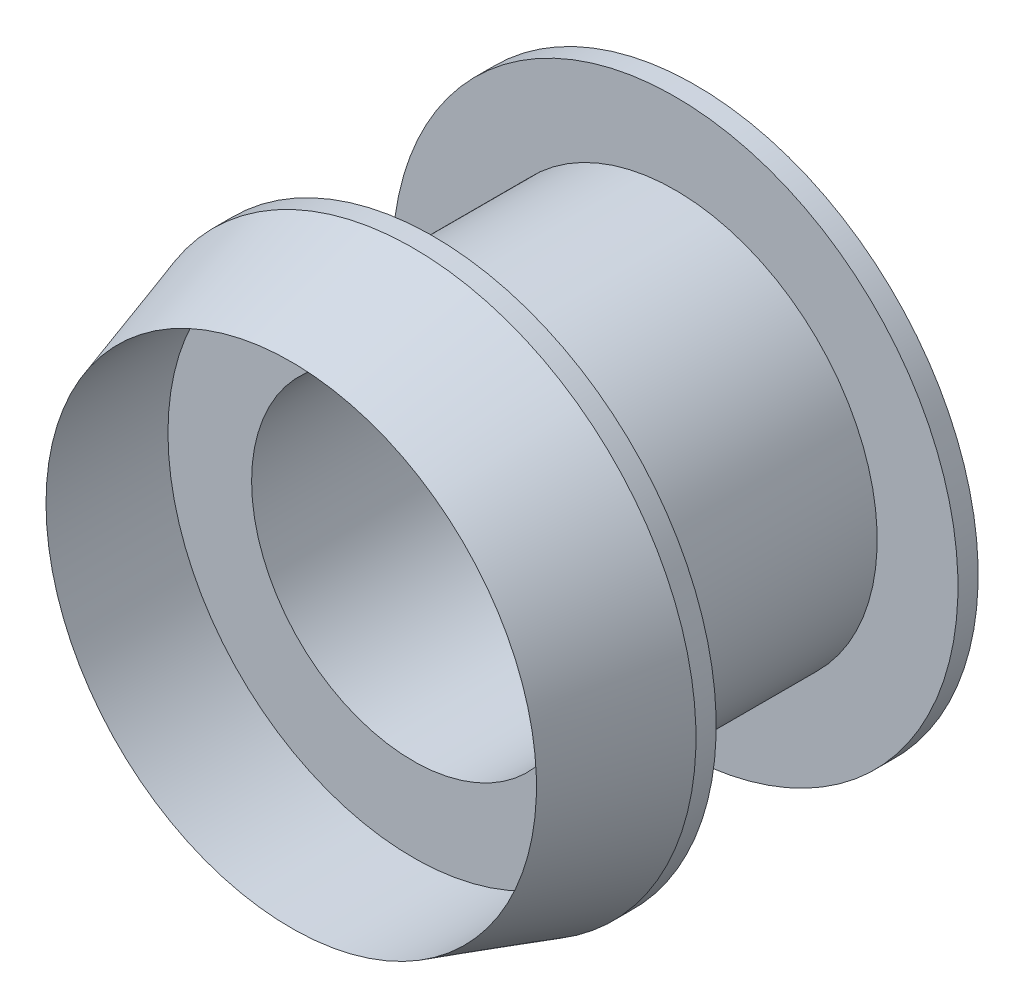
from build123d import *


with BuildPart() as part:
    # Sketch1 → Revolve1 (revolve)
    with BuildSketch(Plane.YZ, mode=Mode.PRIVATE) as revolve1_sk:
        Polygon((-63.5, -0.860872912), (-101.595831724, -0.860872912), (-101.595831724, 5.489127088), (-76.2, 5.489127088), (-76.2, 81.497100008), (-101.595831724, 81.497100008), (-101.595831724, 87.847100008), (-89.789440671, 126.185993668), (-89.789440671, 87.847100008), (-63.5, 87.847100008), align=None)
    revolve(revolve1_sk.sketch.rotate(Axis((0, -12.7, 0), (0, 0, 1)), 270), axis=Axis((0, -12.7, 0), (0, 0, 1)))


solid = part.part
